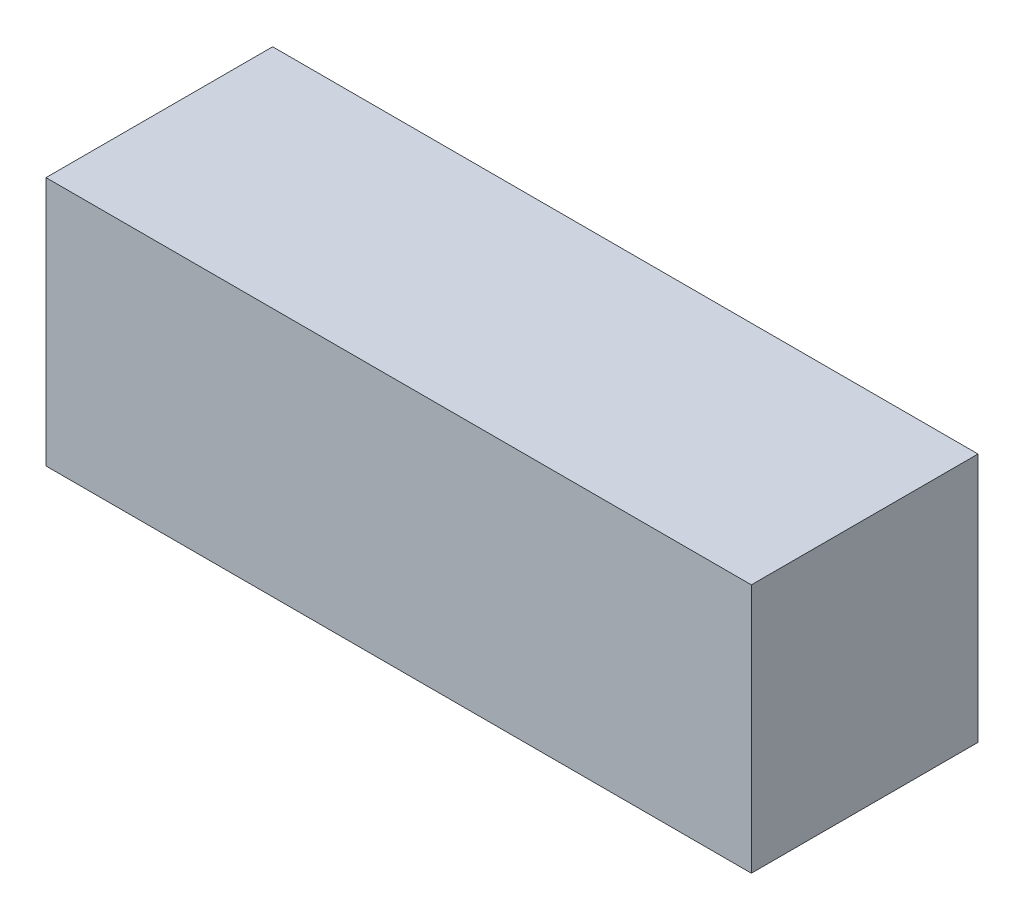
from build123d import *

# Parameters (mm, degrees)
SKETCH1_W           = 154.94
SKETCH1_H           = 49.784
BOSS_EXTRUDE1_DEPTH = 54.864


with BuildPart() as part:
    # Sketch1 → Boss-Extrude1 (new body)
    with BuildSketch(Plane(origin=(0, 0, 0), x_dir=(1, 0, 0), z_dir=(0, 1, 0))):
        with Locations((77.47, 24.892)):
            Rectangle(SKETCH1_W, SKETCH1_H)
    extrude(amount=BOSS_EXTRUDE1_DEPTH)


solid = part.part
